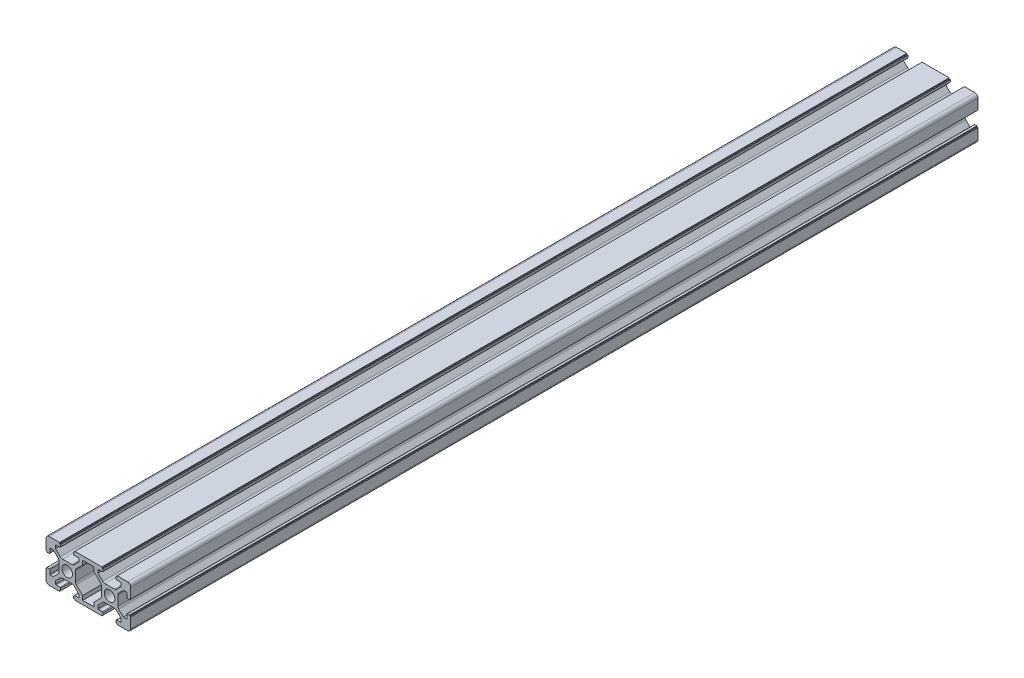
from build123d import *

# Parameters (mm, degrees)
SKETCH_1_R      = 2.5
EXTRUDE_1_DEPTH = 400


with BuildPart() as part:
    # 草图1 → 凸台-拉伸1 (new body)
    with BuildSketch(Plane.XY):
        with BuildLine():
            Line((-0.771587854, 9.545792426), (-5.671587854, 9.545792426))
            Line((-5.671587854, 9.545792426), (-5.671587854, 9.245792426))
            ThreePointArc((-5.671587854, 9.245792426), (-5.730166498, 9.10437107), (-5.871587854, 9.045792426))
            Line((-5.871587854, 9.045792426), (-6.171587854, 9.045792426))
            Line((-6.171587854, 9.045792426), (-6.171587854, 8.045792426))
            ThreePointArc((-6.171587854, 8.045792426), (-6.083719889, 7.833660392), (-5.871587854, 7.745792426))
            Line((-5.871587854, 7.745792426), (-4.071587854, 7.745792426))
            ThreePointArc((-4.071587854, 7.745792426), (-3.85945582, 7.657924461), (-3.771587854, 7.445792426))
            Line((-3.771587854, 7.445792426), (-3.771587854, 6.105792426))
            Line((-3.771587854, 6.105792426), (-5.992248026, 3.885132255))
            ThreePointArc((-5.992248026, 3.885132255), (-6.478883049, 3.559973128), (-7.052908198, 3.445792426))
            Line((-7.052908198, 3.445792426), (-11.490267511, 3.445792426))
            ThreePointArc((-11.490267511, 3.445792426), (-12.064292659, 3.559973128), (-12.550927682, 3.885132255))
            Line((-12.550927682, 3.885132255), (-14.771587854, 6.105792426))
            Line((-14.771587854, 6.105792426), (-14.771587854, 7.445792426))
            ThreePointArc((-14.771587854, 7.445792426), (-14.683719889, 7.657924461), (-14.471587854, 7.745792426))
            Line((-14.471587854, 7.745792426), (-12.671587854, 7.745792426))
            ThreePointArc((-12.671587854, 7.745792426), (-12.45945582, 7.833660392), (-12.371587854, 8.045792426))
            Line((-12.371587854, 8.045792426), (-12.371587854, 9.045792426))
            Line((-12.371587854, 9.045792426), (-12.671587854, 9.045792426))
            ThreePointArc((-12.671587854, 9.045792426), (-12.81300921, 9.10437107), (-12.871587854, 9.245792426))
            Line((-12.871587854, 9.245792426), (-12.871587854, 9.545792426))
            Line((-12.871587854, 9.545792426), (-17.771587854, 9.545792426))
            ThreePointArc((-17.771587854, 9.545792426), (-18.832248026, 9.106452598), (-19.271587854, 8.045792426))
            Line((-19.271587854, 8.045792426), (-19.271587854, 3.145792426))
            Line((-19.271587854, 3.145792426), (-18.971587854, 3.145792426))
            ThreePointArc((-18.971587854, 3.145792426), (-18.830166498, 3.087213783), (-18.771587854, 2.945792426))
            Line((-18.771587854, 2.945792426), (-18.771587854, 2.645792426))
            Line((-18.771587854, 2.645792426), (-17.771587854, 2.645792426))
            ThreePointArc((-17.771587854, 2.645792426), (-17.55945582, 2.733660392), (-17.471587854, 2.945792426))
            Line((-17.471587854, 2.945792426), (-17.471587854, 4.745792426))
            ThreePointArc((-17.471587854, 4.745792426), (-17.383719889, 4.957924461), (-17.171587854, 5.045792426))
            Line((-17.171587854, 5.045792426), (-15.831587854, 5.045792426))
            Line((-15.831587854, 5.045792426), (-13.610927682, 2.825132255))
            ThreePointArc((-13.610927682, 2.825132255), (-13.285768555, 2.338497231), (-13.171587854, 1.764472083))
            Line((-13.171587854, 1.764472083), (-13.171587854, -2.67288723))
            ThreePointArc((-13.171587854, -2.67288723), (-13.285768555, -3.246912379), (-13.610927682, -3.733547402))
            Line((-13.610927682, -3.733547402), (-15.831587854, -5.954207574))
            Line((-15.831587854, -5.954207574), (-17.171587854, -5.954207574))
            ThreePointArc((-17.171587854, -5.954207574), (-17.383719889, -5.866339608), (-17.471587854, -5.654207574))
            Line((-17.471587854, -5.654207574), (-17.471587854, -3.854207574))
            ThreePointArc((-17.471587854, -3.854207574), (-17.55945582, -3.642075539), (-17.771587854, -3.554207574))
            Line((-17.771587854, -3.554207574), (-18.771587854, -3.554207574))
            Line((-18.771587854, -3.554207574), (-18.771587854, -3.854207574))
            ThreePointArc((-18.771587854, -3.854207574), (-18.830166498, -3.99562893), (-18.971587854, -4.054207574))
            Line((-18.971587854, -4.054207574), (-19.271587854, -4.054207574))
            Line((-19.271587854, -4.054207574), (-19.271587854, -8.954207574))
            ThreePointArc((-19.271587854, -8.954207574), (-18.832248026, -10.014867745), (-17.771587854, -10.454207574))
            Line((-17.771587854, -10.454207574), (-12.871587854, -10.454207574))
            Line((-12.871587854, -10.454207574), (-12.871587854, -10.154207574))
            ThreePointArc((-12.871587854, -10.154207574), (-12.81300921, -10.012786217), (-12.671587854, -9.954207574))
            Line((-12.671587854, -9.954207574), (-12.371587854, -9.954207574))
            Line((-12.371587854, -9.954207574), (-12.371587854, -8.954207574))
            ThreePointArc((-12.371587854, -8.954207574), (-12.45945582, -8.742075539), (-12.671587854, -8.654207574))
            Line((-12.671587854, -8.654207574), (-14.471587854, -8.654207574))
            ThreePointArc((-14.471587854, -8.654207574), (-14.683719889, -8.566339608), (-14.771587854, -8.354207574))
            Line((-14.771587854, -8.354207574), (-14.771587854, -7.014207574))
            Line((-14.771587854, -7.014207574), (-12.550927682, -4.793547402))
            ThreePointArc((-12.550927682, -4.793547402), (-12.064292659, -4.468388275), (-11.490267511, -4.354207574))
            Line((-11.490267511, -4.354207574), (-7.052908198, -4.354207574))
            ThreePointArc((-7.052908198, -4.354207574), (-6.478883049, -4.468388275), (-5.992248026, -4.793547402))
            Line((-5.992248026, -4.793547402), (-3.771587854, -7.014207574))
            Line((-3.771587854, -7.014207574), (-3.771587854, -8.354207574))
            ThreePointArc((-3.771587854, -8.354207574), (-3.85945582, -8.566339608), (-4.071587854, -8.654207574))
            Line((-4.071587854, -8.654207574), (-5.871587854, -8.654207574))
            ThreePointArc((-5.871587854, -8.654207574), (-6.083719889, -8.742075539), (-6.171587854, -8.954207574))
            Line((-6.171587854, -8.954207574), (-6.171587854, -9.954207574))
            Line((-6.171587854, -9.954207574), (-5.871587854, -9.954207574))
            ThreePointArc((-5.871587854, -9.954207574), (-5.730166498, -10.012786217), (-5.671587854, -10.154207574))
            Line((-5.671587854, -10.154207574), (-5.671587854, -10.454207574))
            Line((-5.671587854, -10.454207574), (-0.771587854, -10.454207574))
            Line((-0.771587854, -10.454207574), (7.128412146, -10.454207574))
            Line((7.128412146, -10.454207574), (7.128412146, -10.154207574))
            ThreePointArc((7.128412146, -10.154207574), (7.18699079, -10.012786217), (7.328412146, -9.954207574))
            Line((7.328412146, -9.954207574), (7.628412146, -9.954207574))
            Line((7.628412146, -9.954207574), (7.628412146, -8.954207574))
            ThreePointArc((7.628412146, -8.954207574), (7.54054418, -8.742075539), (7.328412146, -8.654207574))
            Line((7.328412146, -8.654207574), (5.528412146, -8.654207574))
            ThreePointArc((5.528412146, -8.654207574), (5.316280111, -8.566339608), (5.228412146, -8.354207574))
            Line((5.228412146, -8.354207574), (5.228412146, -7.014207574))
            Line((5.228412146, -7.014207574), (7.449072318, -4.793547402))
            ThreePointArc((7.449072318, -4.793547402), (7.935707341, -4.468388275), (8.509732489, -4.354207574))
            Line((8.509732489, -4.354207574), (12.947091802, -4.354207574))
            ThreePointArc((12.947091802, -4.354207574), (13.521116951, -4.468388275), (14.007751974, -4.793547402))
            Line((14.007751974, -4.793547402), (16.228412146, -7.014207574))
            Line((16.228412146, -7.014207574), (16.228412146, -8.354207574))
            ThreePointArc((16.228412146, -8.354207574), (16.14054418, -8.566339608), (15.928412146, -8.654207574))
            Line((15.928412146, -8.654207574), (14.128412146, -8.654207574))
            ThreePointArc((14.128412146, -8.654207574), (13.916280111, -8.742075539), (13.828412146, -8.954207574))
            Line((13.828412146, -8.954207574), (13.828412146, -9.954207574))
            Line((13.828412146, -9.954207574), (14.128412146, -9.954207574))
            ThreePointArc((14.128412146, -9.954207574), (14.269833502, -10.012786217), (14.328412146, -10.154207574))
            Line((14.328412146, -10.154207574), (14.328412146, -10.454207574))
            Line((14.328412146, -10.454207574), (19.228412146, -10.454207574))
            ThreePointArc((19.228412146, -10.454207574), (20.289072318, -10.014867745), (20.728412146, -8.954207574))
            Line((20.728412146, -8.954207574), (20.728412146, -4.054207574))
            Line((20.728412146, -4.054207574), (20.428412146, -4.054207574))
            ThreePointArc((20.428412146, -4.054207574), (20.28699079, -3.99562893), (20.228412146, -3.854207574))
            Line((20.228412146, -3.854207574), (20.228412146, -3.554207574))
            Line((20.228412146, -3.554207574), (19.228412146, -3.554207574))
            ThreePointArc((19.228412146, -3.554207574), (19.016280111, -3.642075539), (18.928412146, -3.854207574))
            Line((18.928412146, -3.854207574), (18.928412146, -5.654207574))
            ThreePointArc((18.928412146, -5.654207574), (18.84054418, -5.866339608), (18.628412146, -5.954207574))
            Line((18.628412146, -5.954207574), (17.288412146, -5.954207574))
            Line((17.288412146, -5.954207574), (15.067751974, -3.733547402))
            ThreePointArc((15.067751974, -3.733547402), (14.742592847, -3.246912379), (14.628412146, -2.67288723))
            Line((14.628412146, -2.67288723), (14.628412146, 1.764472083))
            ThreePointArc((14.628412146, 1.764472083), (14.742592847, 2.338497231), (15.067751974, 2.825132255))
            Line((15.067751974, 2.825132255), (17.288412146, 5.045792426))
            Line((17.288412146, 5.045792426), (18.628412146, 5.045792426))
            ThreePointArc((18.628412146, 5.045792426), (18.84054418, 4.957924461), (18.928412146, 4.745792426))
            Line((18.928412146, 4.745792426), (18.928412146, 2.945792426))
            ThreePointArc((18.928412146, 2.945792426), (19.016280111, 2.733660392), (19.228412146, 2.645792426))
            Line((19.228412146, 2.645792426), (20.228412146, 2.645792426))
            Line((20.228412146, 2.645792426), (20.228412146, 2.945792426))
            ThreePointArc((20.228412146, 2.945792426), (20.28699079, 3.087213783), (20.428412146, 3.145792426))
            Line((20.428412146, 3.145792426), (20.728412146, 3.145792426))
            Line((20.728412146, 3.145792426), (20.728412146, 8.045792426))
            ThreePointArc((20.728412146, 8.045792426), (20.289072318, 9.106452598), (19.228412146, 9.545792426))
            Line((19.228412146, 9.545792426), (14.328412146, 9.545792426))
            Line((14.328412146, 9.545792426), (14.328412146, 9.245792426))
            ThreePointArc((14.328412146, 9.245792426), (14.269833502, 9.10437107), (14.128412146, 9.045792426))
            Line((14.128412146, 9.045792426), (13.828412146, 9.045792426))
            Line((13.828412146, 9.045792426), (13.828412146, 8.045792426))
            ThreePointArc((13.828412146, 8.045792426), (13.916280111, 7.833660392), (14.128412146, 7.745792426))
            Line((14.128412146, 7.745792426), (15.928412146, 7.745792426))
            ThreePointArc((15.928412146, 7.745792426), (16.14054418, 7.657924461), (16.228412146, 7.445792426))
            Line((16.228412146, 7.445792426), (16.228412146, 6.105792426))
            Line((16.228412146, 6.105792426), (14.007751974, 3.885132255))
            ThreePointArc((14.007751974, 3.885132255), (13.521116951, 3.559973128), (12.947091802, 3.445792426))
            Line((12.947091802, 3.445792426), (8.509732489, 3.445792426))
            ThreePointArc((8.509732489, 3.445792426), (7.935707341, 3.559973128), (7.449072318, 3.885132255))
            Line((7.449072318, 3.885132255), (5.228412146, 6.105792426))
            Line((5.228412146, 6.105792426), (5.228412146, 7.445792426))
            ThreePointArc((5.228412146, 7.445792426), (5.316280111, 7.657924461), (5.528412146, 7.745792426))
            Line((5.528412146, 7.745792426), (7.328412146, 7.745792426))
            ThreePointArc((7.328412146, 7.745792426), (7.54054418, 7.833660392), (7.628412146, 8.045792426))
            Line((7.628412146, 8.045792426), (7.628412146, 9.045792426))
            Line((7.628412146, 9.045792426), (7.328412146, 9.045792426))
            ThreePointArc((7.328412146, 9.045792426), (7.18699079, 9.10437107), (7.128412146, 9.245792426))
            Line((7.128412146, 9.245792426), (7.128412146, 9.545792426))
            Line((7.128412146, 9.545792426), (2.228412146, 9.545792426))
            Line((2.228412146, 9.545792426), (-0.771587854, 9.545792426))
        make_face()
        with Locations((10.728412146, -0.454207574)):
            Circle(SKETCH_1_R, mode=Mode.SUBTRACT)
        with Locations((-9.271587854, -0.454207574)):
            Circle(SKETCH_1_R, mode=Mode.SUBTRACT)
        with BuildLine():
            Line((-1.971587854, -6.694207574), (-4.932248026, -3.733547402))
            ThreePointArc((-4.932248026, -3.733547402), (-5.257407153, -3.246912379), (-5.371587854, -2.67288723))
            Line((-5.371587854, -2.67288723), (-5.371587854, 1.764472083))
            ThreePointArc((-5.371587854, 1.764472083), (-5.257407153, 2.338497231), (-4.932248026, 2.825132255))
            Line((-4.932248026, 2.825132255), (-1.971587854, 5.785792426))
            Line((-1.971587854, 5.785792426), (-1.971587854, 7.745792426))
            Line((-1.971587854, 7.745792426), (3.428412146, 7.745792426))
            Line((3.428412146, 7.745792426), (3.428412146, 5.785792426))
            Line((3.428412146, 5.785792426), (6.389072318, 2.825132255))
            ThreePointArc((6.389072318, 2.825132255), (6.714231445, 2.338497231), (6.828412146, 1.764472083))
            Line((6.828412146, 1.764472083), (6.828412146, -2.67288723))
            ThreePointArc((6.828412146, -2.67288723), (6.714231445, -3.246912379), (6.389072318, -3.733547402))
            Line((6.389072318, -3.733547402), (3.428412146, -6.694207574))
            Line((3.428412146, -6.694207574), (3.428412146, -8.654207574))
            Line((3.428412146, -8.654207574), (-1.971587854, -8.654207574))
            Line((-1.971587854, -8.654207574), (-1.971587854, -6.694207574))
        make_face(mode=Mode.SUBTRACT)
    extrude(amount=EXTRUDE_1_DEPTH)


solid = part.part
